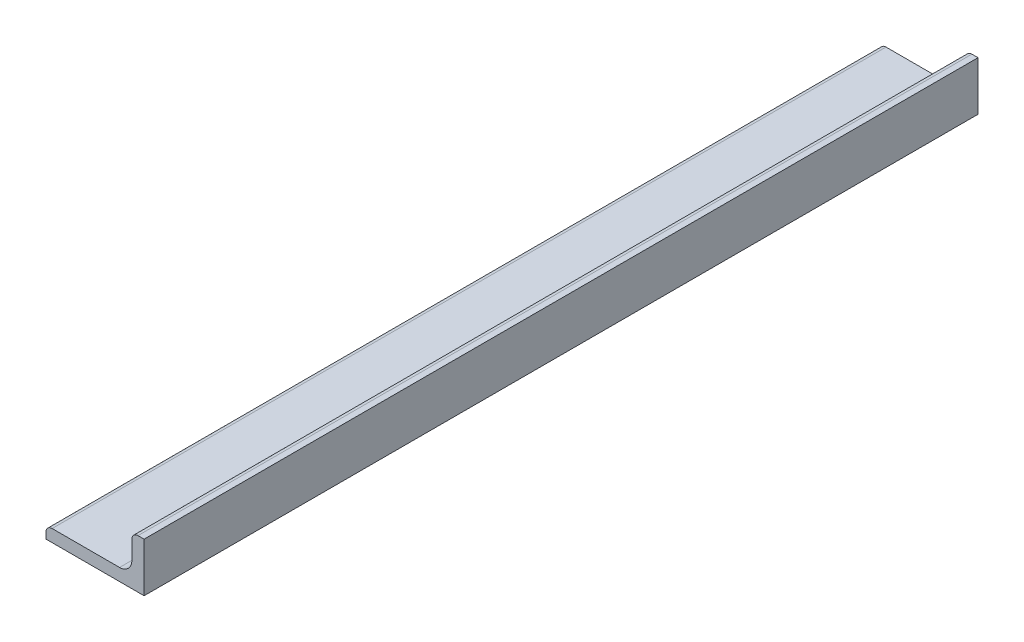
from build123d import *

# Parameters (mm, degrees)
BOSS_EXTRUDE1_DEPTH = 107.95


with BuildPart() as part:
    # Sketch2 → Boss-Extrude1 (new, symmetric)
    with BuildSketch(Plane.XY):
        with BuildLine():
            Line((-12.7, 0), (12.7, 0))
            Line((12.7, 0), (12.7, 12.7))
            Line((12.7, 12.7), (11.1125, 12.7))
            ThreePointArc((11.1125, 12.7), (9.989967985, 12.235032015), (9.525, 11.1125))
            Line((9.525, 11.1125), (9.525, 6.35))
            ThreePointArc((9.525, 6.35), (8.59506403, 4.10493597), (6.35, 3.175))
            Line((6.35, 3.175), (-11.1125, 3.175))
            ThreePointArc((-11.1125, 3.175), (-12.235032015, 2.710032015), (-12.7, 1.5875))
            Line((-12.7, 1.5875), (-12.7, 0))
        make_face()
    extrude(amount=BOSS_EXTRUDE1_DEPTH, both=True)


solid = part.part
